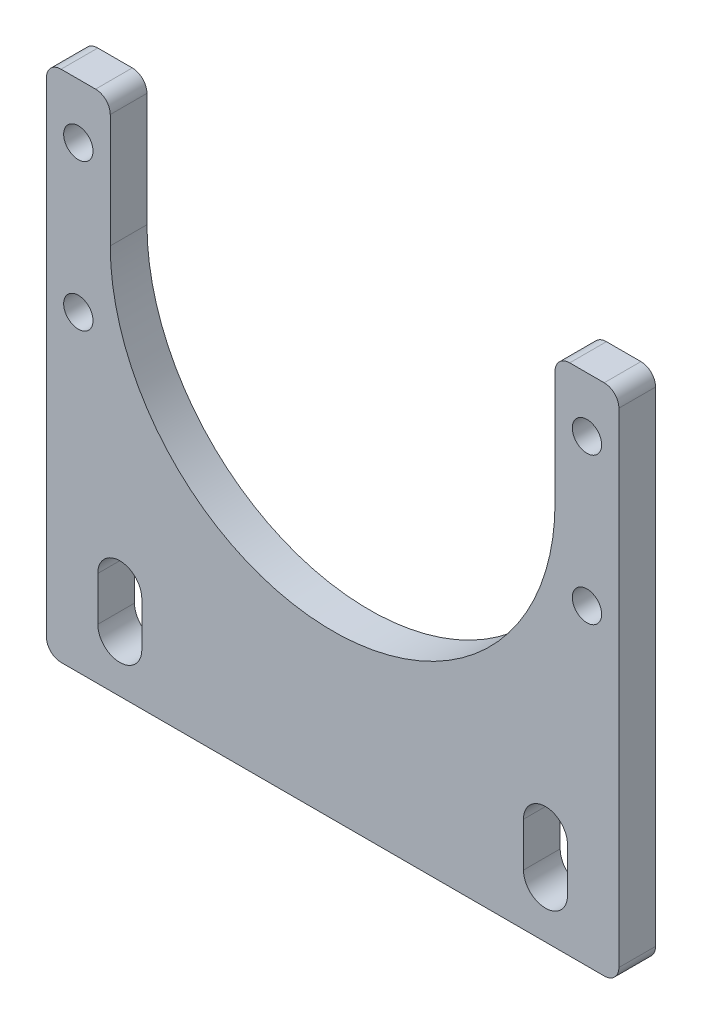
from build123d import *

# Parameters (mm, degrees)
SKETCH_1_R      = 2
EXTRUDE_1_DEPTH = 5
FILLET_2_R      = 2


with BuildPart() as part:
    # 草图1 → 凸台-拉伸1 (new body)
    with BuildSketch(Plane.XY):
        with BuildLine():
            Line((-39, -23.5), (39, -23.5))
            Line((39, -23.5), (39, 46.5))
            Line((39, 46.5), (30.3, 46.5))
            Line((30.3, 46.5), (30.3, 29))
            ThreePointArc((30.3, 29), (0, -1.3), (-30.3, 29))
            Line((-30.3, 29), (-30.3, 46.5))
            Line((-30.3, 46.5), (-39, 46.5))
            Line((-39, 46.5), (-39, -23.5))
        make_face()
        with Locations((-34.65, 39)):
            Circle(SKETCH_1_R, mode=Mode.SUBTRACT)
        with Locations((-34.65, 19)):
            Circle(SKETCH_1_R, mode=Mode.SUBTRACT)
        with Locations((34.65, 19)):
            Circle(SKETCH_1_R, mode=Mode.SUBTRACT)
        with Locations((34.65, 39)):
            Circle(SKETCH_1_R, mode=Mode.SUBTRACT)
        with BuildLine():
            Line((-32, -10.5), (-32, -16.5))
            ThreePointArc((-32, -16.5), (-29, -19.5), (-26, -16.5))
            Line((-26, -16.5), (-26, -10.5))
            ThreePointArc((-26, -10.5), (-29, -7.5), (-32, -10.5))
        make_face(mode=Mode.SUBTRACT)
        with BuildLine():
            Line((26, -10.5), (26, -16.5))
            ThreePointArc((26, -16.5), (29, -19.5), (32, -16.5))
            Line((32, -16.5), (32, -10.5))
            ThreePointArc((32, -10.5), (29, -7.5), (26, -10.5))
        make_face(mode=Mode.SUBTRACT)
    extrude(amount=EXTRUDE_1_DEPTH)

    # 圆角2
    fillet_2_edges = [part.edges().sort_by_distance(p)[0] for p in [
        (30.3, 46.5, 2.5),
        (39, 46.5, 2.5),
        (39, -23.5, 2.5),
        (-39, -23.5, 2.5),
        (-39, 46.5, 2.5),
        (-30.3, 46.5, 2.5),
    ]]
    fillet(fillet_2_edges, radius=FILLET_2_R)


solid = part.part
